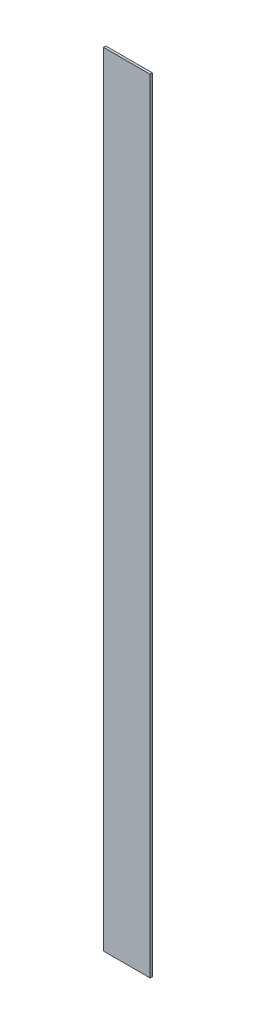
from build123d import *

# Parameters (mm, degrees)
SKETCH1_W           = 0.254
SKETCH1_H           = 84
BOSS_EXTRUDE1_DEPTH = 2.5


with BuildPart() as part:
    # Sketch1 → Boss-Extrude1 (new, symmetric)
    with BuildSketch(Plane(origin=(0, 0, 0), x_dir=(0, 0, -1), z_dir=(1, 0, 0))):
        with Locations((-0.127, 42)):
            Rectangle(SKETCH1_W, SKETCH1_H)
    extrude(amount=BOSS_EXTRUDE1_DEPTH, both=True)


solid = part.part
